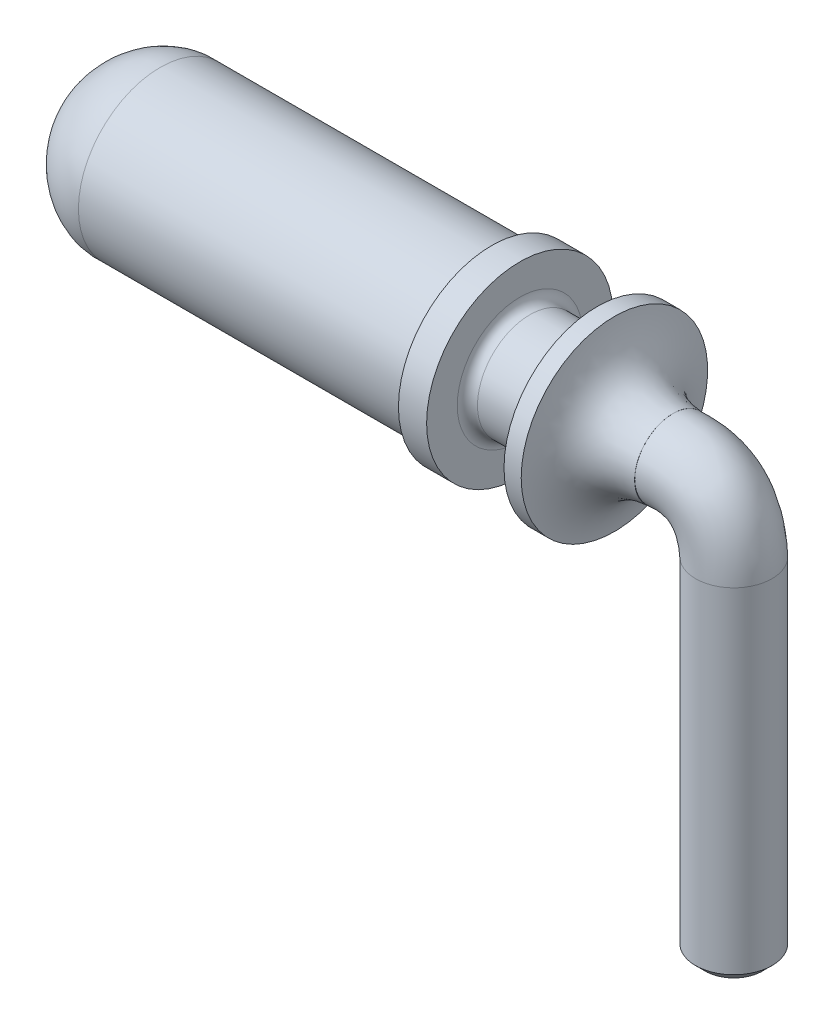
from build123d import *

# Parameters (mm, degrees)
SKETCH2_W     = 0.6
SKETCH2_H     = 4.118227863
SKETCH2_H_2   = 1.3
SKETCH10_R    = 0.6
CHAMFER1_SIZE = 0.15


with BuildPart() as part:
    # Sketch1 → Revolve1 (revolve)
    with BuildSketch(Plane.XY, mode=Mode.PRIVATE) as revolve1_sk:
        with BuildLine():
            Line((1.626095531, 4.986801801), (10.92153598, 4.986801801))
            Line((10.92153598, 4.986801801), (10.92153598, 5.588836435))
            add(Edge.make_bspline(
                [(10.00241881, 6.452631049), (10.113570909, 5.637430805), (10.92153598, 5.588836435)],
                knots=[0, 0, 0, 1, 1, 1], degree=2))
            Line((10.00241881, 6.452631049), (9.732019166, 6.452631049))
            Line((9.732019166, 6.452631049), (9.732019166, 5.958857786))
            ThreePointArc((9.732019166, 5.958857786), (9.688976654, 5.854943969), (9.585062838, 5.811901457))
            Line((9.585062838, 5.811901457), (8.673933602, 5.811901457))
            ThreePointArc((8.673933602, 5.811901457), (8.56170668, 5.85838737), (8.515220767, 5.970614292))
            Line((8.515220767, 5.970614292), (8.515220767, 6.452631049))
            Line((8.515220767, 6.452631049), (8.072127944, 6.452631049))
            Line((8.072127944, 6.452631049), (8.072127944, 6.272997822))
            Line((8.072127944, 6.272997822), (2.861199395, 6.272997822))
            add(Edge.make_bspline(
                [(1.626095531, 4.986801801), (1.568844138, 5.647468558), (2.210932821, 6.320979116), (2.861199395, 6.272997822)],
                knots=[0, 0, 0, 0, 1, 1, 1, 1], degree=3))
        make_face()
    revolve(revolve1_sk.sketch.rotate(Axis((1.626095531, 4.986801801, 0), (1, 0, 0)), 90), axis=Axis((1.626095531, 4.986801801, 0), (1, 0, 0)))



with BuildPart() as body_2:
    # Sketch2 → Revolve2 (revolve)
    with BuildSketch(Plane.XY, mode=Mode.PRIVATE) as revolve2_sk:
        with Locations((12.178892064, 2.059113932)):
            Rectangle(SKETCH2_W, SKETCH2_H)
        with Locations((12.178892064, -0.65)):
            Rectangle(SKETCH2_W, SKETCH2_H_2)
    revolve(revolve2_sk.sketch.rotate(Axis((11.878892064, 4.118227863, 0), (0, -1, 0)), 90), axis=Axis((11.878892064, 4.118227863, 0), (0, -1, 0)))


with BuildPart() as part_1:
    add(part.part)

    add(body_2.part)  # Sweep1 merges body 2
    # Sweep1: sweep along a path in Sketch3
    with BuildLine() as sweep1_path:  # in the path sketch's own coordinates; laid on its plane below (add() does not lay a ready-made edge on the line's plane)
        add(Edge.make_bspline(
            [(10.92153598, 4.986801801), (11.822294838, 5.066317243), (11.878892064, 4.118227863)],
            knots=[0, 0, 0, 1, 1, 1], degree=2))
    # Sketch10 → Sweep1 (sweep)
    with BuildSketch(Plane(origin=(0, 4.118227863, 0), x_dir=(1, 0, 0), z_dir=(0, 1, 0))):
        with Locations((11.878892064, 0)):
            Circle(SKETCH10_R)
    sweep(path=Plane.XY * sweep1_path.line)

    # Chamfer1
    chamfer1_edges = [part_1.edges().sort_by_distance(p)[0] for p in [
        (11.878892064, -1.3, -0.6),
    ]]
    chamfer(chamfer1_edges, length=CHAMFER1_SIZE)


solid = part_1.part
